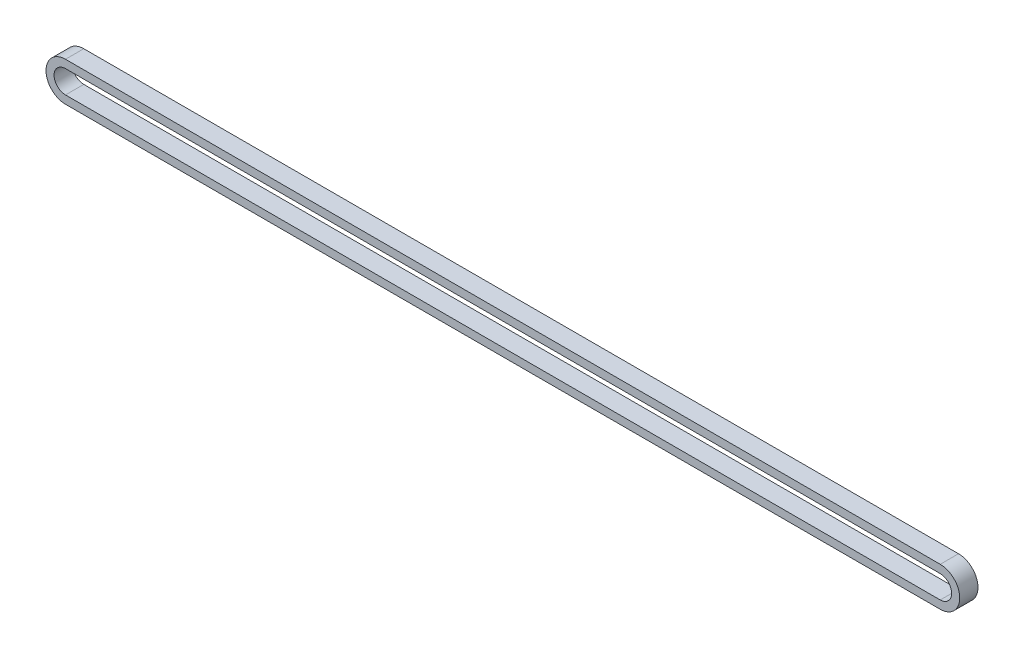
from build123d import *

# Parameters (mm, degrees)
BOSS_EXTRUDE1_DEPTH = 3


with BuildPart() as part:
    # Sketch1 → Boss-Extrude1 (new body)
    with BuildSketch(Plane.XY):
        with BuildLine():
            Line((0, 3.2), (143.6, 3.2))
            ThreePointArc((143.6, 3.2), (146.8, 0), (143.6, -3.2))
            Line((143.6, -3.2), (0, -3.2))
            ThreePointArc((0, -3.2), (-3.2, 0), (0, 3.2))
        make_face()
        with BuildLine():
            Line((0, 1.872), (143.6, 1.872))
            ThreePointArc((143.6, 1.872), (145.472, 0), (143.6, -1.872))
            Line((143.6, -1.872), (0, -1.872))
            ThreePointArc((0, -1.872), (-1.872, 0), (0, 1.872))
        make_face(mode=Mode.SUBTRACT)
    extrude(amount=BOSS_EXTRUDE1_DEPTH)


solid = part.part
